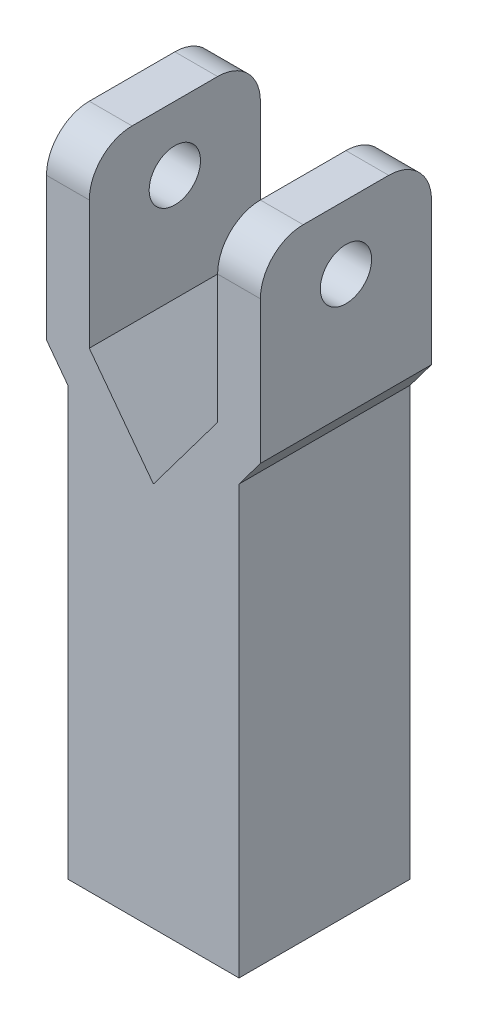
from build123d import *

# Parameters (mm, degrees)
ESTRUSIONE_ESTRUSIONE1_DEPTH = 20
SCHIZZO2_R                   = 6
TAGLIO_ESTRUSIONE1_DEPTH     = 40
RACCORDO1_R                  = 10


with BuildPart() as part:
    # Schizzo1 → Estrusione-Estrusione1 (new, symmetric)
    with BuildSketch(Plane.XY):
        Polygon((-25, 150), (-25, 106.666666667), (-20, 100), (-20, 0), (0, 0), (0, 90), (-15, 110), (-15, 150), align=None)
    extrude(amount=ESTRUSIONE_ESTRUSIONE1_DEPTH, both=True)

    # Schizzo2 → Taglio-Estrusione1 (cut)
    with BuildSketch(Plane.ZY.offset(25)):
        with Locations(Location((0, 135, 0), (0, 0, 270))):
            Circle(SCHIZZO2_R)
    extrude(amount=-TAGLIO_ESTRUSIONE1_DEPTH, mode=Mode.SUBTRACT)

    # Specchia1: part across plane


with BuildPart() as part_1:
    add(part.part)
    add(part.part.mirror(Plane(origin=(0, 0, 20), x_dir=(0, 0, 1), z_dir=(-1, 0, 0))))

    # Raccordo1
    raccordo1_edges = [part_1.edges().sort_by_distance(p)[0] for p in [
        (-20, 150, -20),
        (20, 150, 20),
        (20, 150, -20),
        (-20, 150, 20),
    ]]
    fillet(raccordo1_edges, radius=RACCORDO1_R)


solid = part_1.part
